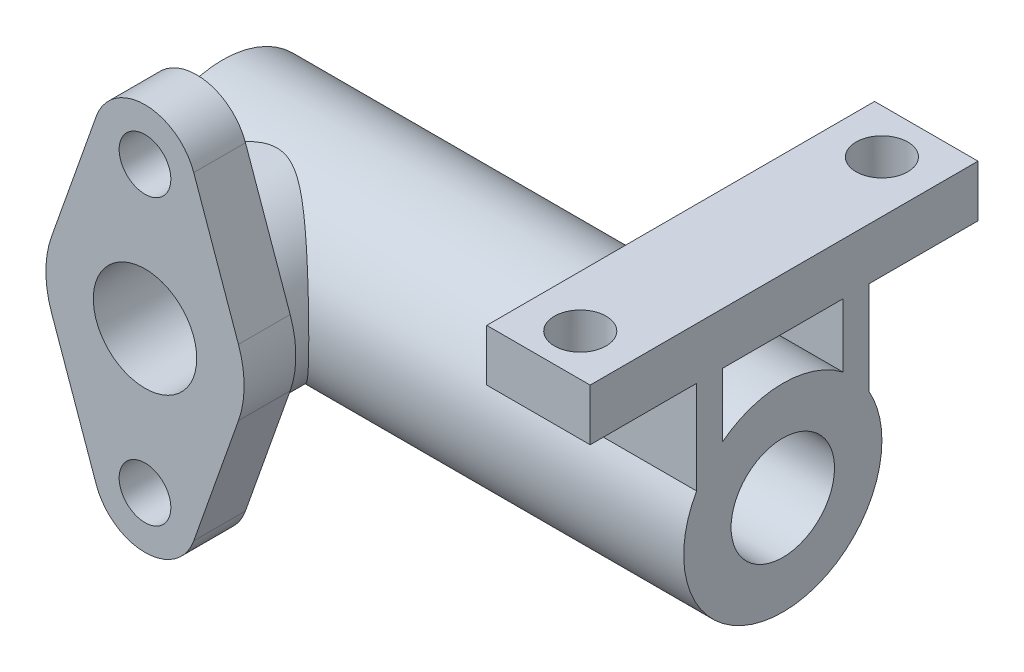
from build123d import *

# Parameters (mm, degrees)
EXTRUDE_1_DEPTH          = 65
EXTRUDE_1_DEPTH_BACK     = 65
SKETCH_1_R               = 23
EXTRUDE_3_DEPTH          = 24
SKETCH_7_R               = 6
CUT_EXTRUDE_3_DEPTH      = 24
SKETCH_8_R               = 21
EXTRUDE_4_DEPTH          = 40
CUT_EXTRUDE_2_DEPTH      = 65
CUT_EXTRUDE_2_DEPTH_BACK = 65
SKETCH_3_R               = 12
CUT_EXTRUDE_1_DEPTH      = 47
CUT_EXTRUDE_1_DEPTH_BACK = 47
SKETCH_2_R               = 15
EXTRUDE_5_DEPTH          = 12
SKETCH_11_R              = 12
SKETCH_11_R_2            = 6
CUT_EXTRUDE_4_DEPTH      = 40


with BuildPart() as part:
    # 草图1 → 凸台-拉伸1 (new, two sides: drawn at the far end of the back side and taken through both)
    with BuildSketch(Plane(origin=(0, 0, 0), x_dir=(0, 0, -1), z_dir=(1, 0, 0)).offset(-EXTRUDE_1_DEPTH_BACK)):
        Circle(SKETCH_1_R)
    extrude(amount=EXTRUDE_1_DEPTH + EXTRUDE_1_DEPTH_BACK)

    # 草图4 → 凸台-拉伸3 (add)
    with BuildSketch(Plane(origin=(65, 0, 0), x_dir=(0, 0, -1), z_dir=(1, 0, 0))):
        Polygon((-20, 33), (-20, 11.357816692), (-14, 18.248287591), (-14, 33), (14, 33), (14, 18.248287591), (20, 11.357816692), (20, 33), (45.296363349, 33), (45.296363349, 45), (-44.703636651, 45), (-44.703636651, 33), align=None)
    extrude(amount=-EXTRUDE_3_DEPTH)

    # 草图7 → 切除-拉伸3 (cut)
    with BuildSketch(Plane(origin=(0, 45, 0), x_dir=(1, 0, 0), z_dir=(0, 1, 0))):
        with Locations((53, 35)):
            Circle(SKETCH_7_R)
        with Locations((53, -35)):
            Circle(SKETCH_7_R)
    extrude(amount=-CUT_EXTRUDE_3_DEPTH, mode=Mode.SUBTRACT)

    # 草图8 → 凸台-拉伸4 (add)
    with BuildSketch(Plane.XY):
        with Locations((-43, 0)):
            Circle(SKETCH_8_R)
    extrude(amount=EXTRUDE_4_DEPTH)

    # 草图3 → 切除-拉伸2 (cut, two sides: drawn at the far end of the back side and taken through both)
    with BuildSketch(Plane(origin=(0, 0, 0), x_dir=(0, 0, -1), z_dir=(1, 0, 0)).offset(-CUT_EXTRUDE_2_DEPTH_BACK)):
        Circle(SKETCH_3_R)
    extrude(amount=CUT_EXTRUDE_2_DEPTH + CUT_EXTRUDE_2_DEPTH_BACK, mode=Mode.SUBTRACT)

    # 草图2 → 切除-拉伸1 (cut, two sides: drawn at the far end of the back side and taken through both)
    with BuildSketch(Plane(origin=(0, 0, 0), x_dir=(0, 0, -1), z_dir=(1, 0, 0)).offset(-CUT_EXTRUDE_1_DEPTH_BACK)):
        Circle(SKETCH_2_R)
    extrude(amount=CUT_EXTRUDE_1_DEPTH + CUT_EXTRUDE_1_DEPTH_BACK, mode=Mode.SUBTRACT)

    # 草图10 → 凸台-拉伸5 (add)
    with BuildSketch(Plane.XY.offset(40)):
        with BuildLine():
            Line((-54.313708499, 37), (-64.684607956, 7.666666667))
            ThreePointArc((-64.684607956, 7.666666667), (-66, 0), (-64.684607956, -7.666666667))
            Line((-64.684607956, -7.666666667), (-54.313708499, -37))
            ThreePointArc((-54.313708499, -37), (-43, -45), (-31.686291501, -37))
            Line((-31.686291501, -37), (-21.315392044, -7.666666667))
            ThreePointArc((-21.315392044, -7.666666667), (-20, 0), (-21.315392044, 7.666666667))
            Line((-21.315392044, 7.666666667), (-31.686291501, 37))
            ThreePointArc((-31.686291501, 37), (-43, 45), (-54.313708499, 37))
        make_face()
    extrude(amount=-EXTRUDE_5_DEPTH)

    # 草图11 → 切除-拉伸4 (cut)
    with BuildSketch(Plane.XY.offset(40)):
        with Locations((-43, 0)):
            Circle(SKETCH_11_R)
        with Locations((-43, 33)):
            Circle(SKETCH_11_R_2)
        with Locations((-43, -33)):
            Circle(SKETCH_11_R_2)
    extrude(amount=-CUT_EXTRUDE_4_DEPTH, mode=Mode.SUBTRACT)


solid = part.part
